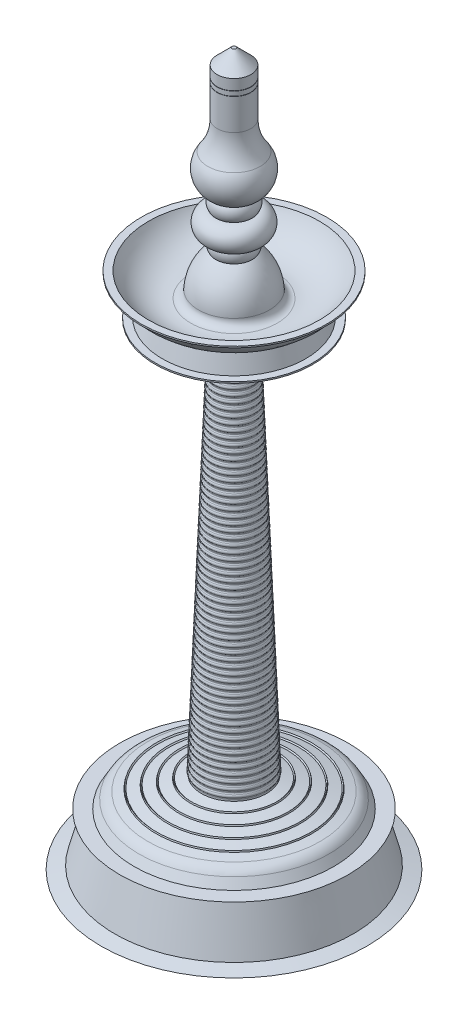
from build123d import *


with BuildPart() as part:
    # Sketch1 → Revolve1 (revolve)
    with BuildSketch(Plane.XY, mode=Mode.PRIVATE) as revolve1_sk:
        with BuildLine():
            Line((0, 0), (0, 1500))
            Line((0, 1500), (4.146366125, 1500))
            Line((4.146366125, 1500), (35.55917972, 1468.587186405))
            Line((35.55917972, 1468.587186405), (35.55917972, 1446.385384253))
            Line((35.55917972, 1446.385384253), (34.598258429, 1446.108562516))
            Line((34.598258429, 1446.108562516), (35.55917972, 1445.831740779))
            Line((35.55917972, 1445.831740779), (35.55917972, 1436.385384253))
            Line((35.55917972, 1436.385384253), (34.598258429, 1436.108562516))
            Line((34.598258429, 1436.108562516), (35.55917972, 1435.831740779))
            Line((35.55917972, 1435.831740779), (35.55917972, 1369.908923142))
            ThreePointArc((35.55917972, 1369.908923142), (40.564503358, 1338.667740979), (55.079408979, 1310.554003367))
            ThreePointArc((55.079408979, 1310.554003367), (63.664014173, 1268.692665537), (37.325157619, 1235.042529033))
            ThreePointArc((37.325157619, 1235.042529033), (42.03903574, 1221.441743023), (38.054859782, 1207.60959319))
            ThreePointArc((38.054859782, 1207.60959319), (64.086349391, 1181.890338054), (38.367094255, 1155.858848446))
            ThreePointArc((38.367094255, 1155.858848446), (41.441653525, 1144.021783008), (38.367094255, 1132.184717571))
            ThreePointArc((38.367094255, 1132.184717571), (64.372038769, 1099.328636815), (75, 1058.796851486))
            ThreePointArc((75, 1058.796851486), (79.533896643, 1047.290152225), (90.876310781, 1042.359636209))
            ThreePointArc((90.876310781, 1042.359636209), (143.636128622, 1053.500194268), (180.337905252, 1093.005763555))
            Line((180.337905252, 1093.005763555), (195.337905252, 1093.005763555))
            Line((195.337905252, 1093.005763555), (195.337905252, 1090.005763555))
            Line((195.337905252, 1090.005763555), (187.60713633, 1090.005763555))
            ThreePointArc((187.60713633, 1090.005763555), (169.093237087, 1063.190582401), (140.445446097, 1047.662463489))
            Line((140.445446097, 1047.662463489), (151.163413794, 1007.662463489))
            Line((151.163413794, 1007.662463489), (166.163413794, 1007.662463489))
            Line((166.163413794, 1007.662463489), (166.163413794, 1004.662463489))
            Line((166.163413794, 1004.662463489), (37.325157619, 1004.662463489))
            Line((37.325157619, 1004.662463489), (37.367372239, 1003.53674031))
            ThreePointArc((37.367372239, 1003.53674031), (37.683576238, 1001.96486419), (38.481059373, 1000.57389325))
            ThreePointArc((38.481059373, 1000.57389325), (39.594746508, 997.61104619), (38.7060887, 994.573111195))
            ThreePointArc((38.7060887, 994.573111195), (38.015021659, 993.126319624), (37.817430893, 991.5351762))
            Line((37.817430893, 991.5351762), (37.845161411, 990.79569571))
            ThreePointArc((37.845161411, 990.79569571), (38.161365411, 989.22381959), (38.958848546, 987.83284865))
            ThreePointArc((38.958848546, 987.83284865), (40.072535681, 984.87000159), (39.183877873, 981.832066595))
            ThreePointArc((39.183877873, 981.832066595), (38.492810832, 980.385275024), (38.295220065, 978.7941316))
            Line((38.295220065, 978.7941316), (38.322950584, 978.054651109))
            ThreePointArc((38.322950584, 978.054651109), (38.639154583, 976.482774989), (39.436637718, 975.09180405))
            ThreePointArc((39.436637718, 975.09180405), (40.550324853, 972.12895699), (39.661667045, 969.091021995))
            ThreePointArc((39.661667045, 969.091021995), (38.970600004, 967.644230424), (38.773009238, 966.053087))
            Line((38.773009238, 966.053087), (38.800739756, 965.313606509))
            ThreePointArc((38.800739756, 965.313606509), (39.116943756, 963.741730389), (39.914426891, 962.350759449))
            ThreePointArc((39.914426891, 962.350759449), (41.028114026, 959.38791239), (40.139456218, 956.349977395))
            ThreePointArc((40.139456218, 956.349977395), (39.448389177, 954.903185823), (39.25079841, 953.312042399))
            Line((39.25079841, 953.312042399), (39.278528929, 952.572561909))
            ThreePointArc((39.278528929, 952.572561909), (39.594732928, 951.000685789), (40.392216063, 949.609714849))
            ThreePointArc((40.392216063, 949.609714849), (41.505903198, 946.646867789), (40.61724539, 943.608932794))
            ThreePointArc((40.61724539, 943.608932794), (39.926178349, 942.162141223), (39.728587583, 940.570997799))
            Line((39.728587583, 940.570997799), (39.756318101, 939.831517308))
            ThreePointArc((39.756318101, 939.831517308), (40.072522101, 938.259641188), (40.870005236, 936.868670249))
            ThreePointArc((40.870005236, 936.868670249), (41.983692371, 933.905823189), (41.095034563, 930.867888194))
            ThreePointArc((41.095034563, 930.867888194), (40.403967522, 929.421096623), (40.206376755, 927.829953199))
            Line((40.206376755, 927.829953199), (40.234107274, 927.090472708))
            ThreePointArc((40.234107274, 927.090472708), (40.550311273, 925.518596588), (41.347794408, 924.127625648))
            ThreePointArc((41.347794408, 924.127625648), (42.461481543, 921.164778589), (41.572823735, 918.126843594))
            ThreePointArc((41.572823735, 918.126843594), (40.881756694, 916.680052022), (40.684165928, 915.088908599))
            Line((40.684165928, 915.088908599), (40.711896446, 914.349428108))
            ThreePointArc((40.711896446, 914.349428108), (41.028100446, 912.777551988), (41.825583581, 911.386581048))
            ThreePointArc((41.825583581, 911.386581048), (42.939270716, 908.423733988), (42.050612908, 905.385798993))
            ThreePointArc((42.050612908, 905.385798993), (41.359545867, 903.939007422), (41.1619551, 902.347863998))
            Line((41.1619551, 902.347863998), (41.189685619, 901.608383508))
            ThreePointArc((41.189685619, 901.608383508), (41.505889618, 900.036507388), (42.303372753, 898.645536448))
            ThreePointArc((42.303372753, 898.645536448), (43.417059888, 895.682689388), (42.52840208, 892.644754393))
            ThreePointArc((42.52840208, 892.644754393), (41.837335039, 891.197962822), (41.639744273, 889.606819398))
            Line((41.639744273, 889.606819398), (41.667474791, 888.867338907))
            ThreePointArc((41.667474791, 888.867338907), (41.983678791, 887.295462787), (42.781161926, 885.904491848))
            ThreePointArc((42.781161926, 885.904491848), (43.894849061, 882.941644788), (43.006191253, 879.903709793))
            ThreePointArc((43.006191253, 879.903709793), (42.315124212, 878.456918222), (42.117533445, 876.865774798))
            Line((42.117533445, 876.865774798), (42.145263964, 876.126294307))
            ThreePointArc((42.145263964, 876.126294307), (42.461467963, 874.554418187), (43.258951098, 873.163447247))
            ThreePointArc((43.258951098, 873.163447247), (44.372638233, 870.200600188), (43.483980426, 867.162665193))
            ThreePointArc((43.483980426, 867.162665193), (42.792913384, 865.715873621), (42.595322618, 864.124730197))
            Line((42.595322618, 864.124730197), (42.623053136, 863.385249707))
            ThreePointArc((42.623053136, 863.385249707), (42.939257136, 861.813373587), (43.736740271, 860.422402647))
            ThreePointArc((43.736740271, 860.422402647), (44.850427406, 857.459555587), (43.961769598, 854.421620592))
            ThreePointArc((43.961769598, 854.421620592), (43.270702557, 852.974829021), (43.07311179, 851.383685597))
            Line((43.07311179, 851.383685597), (43.100842309, 850.644205106))
            ThreePointArc((43.100842309, 850.644205106), (43.417046308, 849.072328986), (44.214529443, 847.681358047))
            ThreePointArc((44.214529443, 847.681358047), (45.328216578, 844.718510987), (44.439558771, 841.680575992))
            ThreePointArc((44.439558771, 841.680575992), (43.748491729, 840.233784421), (43.550900963, 838.642640997))
            Line((43.550900963, 838.642640997), (43.578631481, 837.903160506))
            ThreePointArc((43.578631481, 837.903160506), (43.894835481, 836.331284386), (44.692318616, 834.940313446))
            ThreePointArc((44.692318616, 834.940313446), (45.806005751, 831.977466387), (44.917347943, 828.939531392))
            ThreePointArc((44.917347943, 828.939531392), (44.226280902, 827.49273982), (44.028690135, 825.901596397))
            Line((44.028690135, 825.901596397), (44.056420654, 825.162115906))
            ThreePointArc((44.056420654, 825.162115906), (44.372624653, 823.590239786), (45.170107789, 822.199268846))
            ThreePointArc((45.170107789, 822.199268846), (46.283794923, 819.236421786), (45.395137116, 816.198486791))
            ThreePointArc((45.395137116, 816.198486791), (44.704070074, 814.75169522), (44.506479308, 813.160551796))
            Line((44.506479308, 813.160551796), (44.534209826, 812.421071306))
            ThreePointArc((44.534209826, 812.421071306), (44.850413826, 810.849195185), (45.647896961, 809.458224246))
            ThreePointArc((45.647896961, 809.458224246), (46.761584096, 806.495377186), (45.872926288, 803.457442191))
            ThreePointArc((45.872926288, 803.457442191), (45.181859247, 802.01065062), (44.98426848, 800.419507196))
            Line((44.98426848, 800.419507196), (45.011998999, 799.680026705))
            ThreePointArc((45.011998999, 799.680026705), (45.328202998, 798.108150585), (46.125686134, 796.717179646))
            ThreePointArc((46.125686134, 796.717179646), (47.239373268, 793.754332586), (46.350715461, 790.716397591))
            ThreePointArc((46.350715461, 790.716397591), (45.65964842, 789.269606019), (45.462057653, 787.678462596))
            Line((45.462057653, 787.678462596), (45.489788171, 786.938982105))
            ThreePointArc((45.489788171, 786.938982105), (45.805992171, 785.367105985), (46.603475306, 783.976135045))
            ThreePointArc((46.603475306, 783.976135045), (47.717162441, 781.013287986), (46.828504633, 777.97535299))
            ThreePointArc((46.828504633, 777.97535299), (46.137437592, 776.528561419), (45.939846825, 774.937417995))
            Line((45.939846825, 774.937417995), (45.967577344, 774.197937505))
            ThreePointArc((45.967577344, 774.197937505), (46.283781343, 772.626061385), (47.081264479, 771.235090445))
            ThreePointArc((47.081264479, 771.235090445), (48.194951613, 768.272243385), (47.306293806, 765.23430839))
            ThreePointArc((47.306293806, 765.23430839), (46.615226765, 763.787516819), (46.417635998, 762.196373395))
            Line((46.417635998, 762.196373395), (46.445366516, 761.456892904))
            ThreePointArc((46.445366516, 761.456892904), (46.761570516, 759.885016784), (47.559053651, 758.494045845))
            ThreePointArc((47.559053651, 758.494045845), (48.672740786, 755.531198785), (47.784082978, 752.49326379))
            ThreePointArc((47.784082978, 752.49326379), (47.093015937, 751.046472219), (46.89542517, 749.455328795))
            Line((46.89542517, 749.455328795), (46.923155689, 748.715848304))
            ThreePointArc((46.923155689, 748.715848304), (47.239359688, 747.143972184), (48.036842824, 745.753001244))
            ThreePointArc((48.036842824, 745.753001244), (49.150529958, 742.790154185), (48.261872151, 739.75221919))
            ThreePointArc((48.261872151, 739.75221919), (47.57080511, 738.305427618), (47.373214343, 736.714284195))
            Line((47.373214343, 736.714284195), (47.400944861, 735.974803704))
            ThreePointArc((47.400944861, 735.974803704), (47.717148861, 734.402927584), (48.514631996, 733.011956644))
            ThreePointArc((48.514631996, 733.011956644), (49.628319131, 730.049109584), (48.739661323, 727.011174589))
            ThreePointArc((48.739661323, 727.011174589), (48.048594282, 725.564383018), (47.851003515, 723.973239594))
            Line((47.851003515, 723.973239594), (47.878734034, 723.233759103))
            ThreePointArc((47.878734034, 723.233759103), (48.194938033, 721.661882983), (48.992421169, 720.270912044))
            ThreePointArc((48.992421169, 720.270912044), (50.106108303, 717.308064984), (49.217450496, 714.270129989))
            ThreePointArc((49.217450496, 714.270129989), (48.526383455, 712.823338418), (48.328792688, 711.232194994))
            Line((48.328792688, 711.232194994), (48.356523206, 710.492714503))
            ThreePointArc((48.356523206, 710.492714503), (48.672727206, 708.920838383), (49.470210341, 707.529867443))
            ThreePointArc((49.470210341, 707.529867443), (50.583897476, 704.567020384), (49.695239668, 701.529085389))
            ThreePointArc((49.695239668, 701.529085389), (49.004172627, 700.082293817), (48.80658186, 698.491150394))
            Line((48.80658186, 698.491150394), (48.834312379, 697.751669903))
            ThreePointArc((48.834312379, 697.751669903), (49.150516378, 696.179793783), (49.947999514, 694.788822843))
            ThreePointArc((49.947999514, 694.788822843), (51.061686648, 691.825975783), (50.173028841, 688.788040788))
            ThreePointArc((50.173028841, 688.788040788), (49.4819618, 687.341249217), (49.284371033, 685.750105793))
            Line((49.284371033, 685.750105793), (49.312101551, 685.010625303))
            ThreePointArc((49.312101551, 685.010625303), (49.628305551, 683.438749183), (50.425788686, 682.047778243))
            ThreePointArc((50.425788686, 682.047778243), (51.539475821, 679.084931183), (50.650818013, 676.046996188))
            ThreePointArc((50.650818013, 676.046996188), (49.959750972, 674.600204617), (49.762160205, 673.009061193))
            Line((49.762160205, 673.009061193), (49.789890724, 672.269580702))
            ThreePointArc((49.789890724, 672.269580702), (50.106094723, 670.697704582), (50.903577859, 669.306733643))
            ThreePointArc((50.903577859, 669.306733643), (52.017264993, 666.343886583), (51.128607186, 663.305951588))
            ThreePointArc((51.128607186, 663.305951588), (50.437540145, 661.859160017), (50.239949378, 660.268016593))
            Line((50.239949378, 660.268016593), (50.267679896, 659.528536102))
            ThreePointArc((50.267679896, 659.528536102), (50.583883896, 657.956659982), (51.381367031, 656.565689042))
            ThreePointArc((51.381367031, 656.565689042), (52.495054166, 653.602841983), (51.606396358, 650.564906988))
            ThreePointArc((51.606396358, 650.564906988), (50.915329317, 649.118115416), (50.717738551, 647.526971992))
            Line((50.717738551, 647.526971992), (50.745469069, 646.787491502))
            ThreePointArc((50.745469069, 646.787491502), (51.061673068, 645.215615382), (51.859156204, 643.824644442))
            ThreePointArc((51.859156204, 643.824644442), (52.972843338, 640.861797382), (52.084185531, 637.823862387))
            ThreePointArc((52.084185531, 637.823862387), (51.39311849, 636.377070816), (51.195527723, 634.785927392))
            Line((51.195527723, 634.785927392), (51.223258241, 634.046446901))
            ThreePointArc((51.223258241, 634.046446901), (51.539462241, 632.474570781), (52.336945376, 631.083599842))
            ThreePointArc((52.336945376, 631.083599842), (53.450632511, 628.120752782), (52.561974703, 625.082817787))
            ThreePointArc((52.561974703, 625.082817787), (51.870907662, 623.636026216), (51.673316896, 622.044882792))
            Line((51.673316896, 622.044882792), (51.701047414, 621.305402301))
            ThreePointArc((51.701047414, 621.305402301), (52.017251413, 619.733526181), (52.814734549, 618.342555241))
            ThreePointArc((52.814734549, 618.342555241), (53.928421684, 615.379708182), (53.039763876, 612.341773187))
            ThreePointArc((53.039763876, 612.341773187), (52.348696835, 610.894981615), (52.151106068, 609.303838192))
            Line((52.151106068, 609.303838192), (52.178836586, 608.564357701))
            ThreePointArc((52.178836586, 608.564357701), (52.495040586, 606.992481581), (53.292523721, 605.601510641))
            ThreePointArc((53.292523721, 605.601510641), (54.406210856, 602.638663581), (53.517553048, 599.600728586))
            ThreePointArc((53.517553048, 599.600728586), (52.826486007, 598.153937015), (52.628895241, 596.562793591))
            Line((52.628895241, 596.562793591), (52.656625759, 595.823313101))
            ThreePointArc((52.656625759, 595.823313101), (52.972829759, 594.251436981), (53.770312894, 592.860466041))
            ThreePointArc((53.770312894, 592.860466041), (54.884000029, 589.897618981), (53.995342221, 586.859683986))
            ThreePointArc((53.995342221, 586.859683986), (53.30427518, 585.412892415), (53.106684413, 583.821748991))
            Line((53.106684413, 583.821748991), (53.134414931, 583.0822685))
            ThreePointArc((53.134414931, 583.0822685), (53.450618931, 581.51039238), (54.248102066, 580.119421441))
            ThreePointArc((54.248102066, 580.119421441), (55.361789201, 577.156574381), (54.473131393, 574.118639386))
            ThreePointArc((54.473131393, 574.118639386), (53.782064352, 572.671847815), (53.584473586, 571.080704391))
            Line((53.584473586, 571.080704391), (53.612204104, 570.3412239))
            ThreePointArc((53.612204104, 570.3412239), (53.928408104, 568.76934778), (54.725891239, 567.37837684))
            ThreePointArc((54.725891239, 567.37837684), (55.839578374, 564.415529781), (54.950920566, 561.377594786))
            ThreePointArc((54.950920566, 561.377594786), (54.259853525, 559.930803214), (54.062262758, 558.33965979))
            Line((54.062262758, 558.33965979), (54.089993277, 557.6001793))
            ThreePointArc((54.089993277, 557.6001793), (54.406197276, 556.02830318), (55.203680411, 554.63733224))
            ThreePointArc((55.203680411, 554.63733224), (56.317367546, 551.67448518), (55.428709738, 548.636550185))
            ThreePointArc((55.428709738, 548.636550185), (54.737642697, 547.189758614), (54.540051931, 545.59861519))
            Line((54.540051931, 545.59861519), (54.567782449, 544.859134699))
            ThreePointArc((54.567782449, 544.859134699), (54.883986449, 543.287258579), (55.681469584, 541.89628764))
            ThreePointArc((55.681469584, 541.89628764), (56.795156719, 538.93344058), (55.906498911, 535.895505585))
            ThreePointArc((55.906498911, 535.895505585), (55.21543187, 534.448714014), (55.017841103, 532.85757059))
            Line((55.017841103, 532.85757059), (55.045571622, 532.118090099))
            ThreePointArc((55.045571622, 532.118090099), (55.361775621, 530.546213979), (56.159258756, 529.155243039))
            ThreePointArc((56.159258756, 529.155243039), (57.272945891, 526.19239598), (56.384288083, 523.154460985))
            ThreePointArc((56.384288083, 523.154460985), (55.693221042, 521.707669413), (55.495630276, 520.11652599))
            Line((55.495630276, 520.11652599), (55.523360794, 519.377045499))
            ThreePointArc((55.523360794, 519.377045499), (55.839564794, 517.805169379), (56.637047929, 516.414198439))
            ThreePointArc((56.637047929, 516.414198439), (57.750735064, 513.451351379), (56.862077256, 510.413416384))
            ThreePointArc((56.862077256, 510.413416384), (56.171010215, 508.966624813), (55.973419448, 507.375481389))
            Line((55.973419448, 507.375481389), (56.001149967, 506.636000899))
            ThreePointArc((56.001149967, 506.636000899), (56.317353966, 505.064124778), (57.114837101, 503.673153839))
            ThreePointArc((57.114837101, 503.673153839), (58.228524236, 500.710306779), (57.339866428, 497.672371784))
            ThreePointArc((57.339866428, 497.672371784), (56.648799387, 496.225580213), (56.451208621, 494.634436789))
            Line((56.451208621, 494.634436789), (56.478939139, 493.894956298))
            ThreePointArc((56.478939139, 493.894956298), (56.795143139, 492.323080178), (57.592626274, 490.932109239))
            ThreePointArc((57.592626274, 490.932109239), (58.706313409, 487.969262179), (57.817655601, 484.931327184))
            ThreePointArc((57.817655601, 484.931327184), (57.12658856, 483.484535612), (56.928997793, 481.893392189))
            Line((56.928997793, 481.893392189), (56.956728312, 481.153911698))
            ThreePointArc((56.956728312, 481.153911698), (57.272932311, 479.582035578), (58.070415446, 478.191064638))
            ThreePointArc((58.070415446, 478.191064638), (59.184102581, 475.228217579), (58.295444773, 472.190282583))
            ThreePointArc((58.295444773, 472.190282583), (57.604377732, 470.743491012), (57.406786966, 469.152347588))
            Line((57.406786966, 469.152347588), (57.434517484, 468.412867098))
            ThreePointArc((57.434517484, 468.412867098), (57.750721484, 466.840990978), (58.548204619, 465.450020038))
            ThreePointArc((58.548204619, 465.450020038), (59.661891754, 462.487172978), (58.773233946, 459.449237983))
            ThreePointArc((58.773233946, 459.449237983), (58.082166905, 458.002446412), (57.884576138, 456.411302988))
            Line((57.884576138, 456.411302988), (57.912306657, 455.671822497))
            ThreePointArc((57.912306657, 455.671822497), (58.228510656, 454.099946377), (59.025993791, 452.708975438))
            ThreePointArc((59.025993791, 452.708975438), (60.139680926, 449.746128378), (59.251023118, 446.708193383))
            ThreePointArc((59.251023118, 446.708193383), (58.559956077, 445.261401812), (58.362365311, 443.670258388))
            Line((58.362365311, 443.670258388), (58.390095829, 442.930777897))
            ThreePointArc((58.390095829, 442.930777897), (58.706299829, 441.358901777), (59.503782964, 439.967930837))
            ThreePointArc((59.503782964, 439.967930837), (60.617470099, 437.005083778), (59.728812291, 433.967148783))
            ThreePointArc((59.728812291, 433.967148783), (59.03774525, 432.520357211), (58.840154483, 430.929213788))
            Line((58.840154483, 430.929213788), (58.867885002, 430.189733297))
            ThreePointArc((58.867885002, 430.189733297), (59.184089001, 428.617857177), (59.981572136, 427.226886237))
            ThreePointArc((59.981572136, 427.226886237), (61.095259271, 424.264039177), (60.206601463, 421.226104182))
            ThreePointArc((60.206601463, 421.226104182), (59.515534422, 419.779312611), (59.317943656, 418.188169187))
            Line((59.317943656, 418.188169187), (59.345674174, 417.448688696))
            ThreePointArc((59.345674174, 417.448688696), (59.661878174, 415.876812576), (60.459361309, 414.485841637))
            ThreePointArc((60.459361309, 414.485841637), (61.573048444, 411.522994577), (60.684390636, 408.485059582))
            ThreePointArc((60.684390636, 408.485059582), (59.993323595, 407.038268011), (59.795732828, 405.447124587))
            Line((59.795732828, 405.447124587), (59.823463347, 404.707644096))
            ThreePointArc((59.823463347, 404.707644096), (60.139667346, 403.135767976), (60.937150481, 401.744797036))
            ThreePointArc((60.937150481, 401.744797036), (62.050837616, 398.781949977), (61.162179809, 395.744014982))
            ThreePointArc((61.162179809, 395.744014982), (60.471112767, 394.29722341), (60.273522001, 392.706079987))
            Line((60.273522001, 392.706079987), (60.301252519, 391.966599496))
            ThreePointArc((60.301252519, 391.966599496), (60.617456519, 390.394723376), (61.414939654, 389.003752436))
            ThreePointArc((61.414939654, 389.003752436), (62.528626789, 386.040905376), (61.639968981, 383.002970381))
            ThreePointArc((61.639968981, 383.002970381), (60.94890194, 381.55617881), (60.751311173, 379.965035386))
            Line((60.751311173, 379.965035386), (60.779041692, 379.225554896))
            ThreePointArc((60.779041692, 379.225554896), (61.095245691, 377.653678776), (61.892728826, 376.262707836))
            ThreePointArc((61.892728826, 376.262707836), (63.006415961, 373.299860776), (62.117758154, 370.261925781))
            ThreePointArc((62.117758154, 370.261925781), (61.426691112, 368.81513421), (61.229100346, 367.223990786))
            Line((61.229100346, 367.223990786), (61.256830864, 366.484510295))
            ThreePointArc((61.256830864, 366.484510295), (61.573034864, 364.912634175), (62.370517999, 363.521663236))
            ThreePointArc((62.370517999, 363.521663236), (63.484205134, 360.558816176), (62.595547326, 357.520881181))
            ThreePointArc((62.595547326, 357.520881181), (61.904480285, 356.07408961), (61.706889518, 354.482946186))
            Line((61.706889518, 354.482946186), (61.734620037, 353.743465695))
            ThreePointArc((61.734620037, 353.743465695), (62.050824036, 352.171589575), (62.848307172, 350.780618635))
            ThreePointArc((62.848307172, 350.780618635), (63.961994306, 347.817771576), (63.073336499, 344.779836581))
            ThreePointArc((63.073336499, 344.779836581), (62.382269457, 343.333045009), (62.184678691, 341.741901585))
            Line((62.184678691, 341.741901585), (62.212409209, 341.002421095))
            ThreePointArc((62.212409209, 341.002421095), (62.528613209, 339.430544975), (63.326096344, 338.039574035))
            ThreePointArc((63.326096344, 338.039574035), (64.439783479, 335.076726975), (63.551125671, 332.03879198))
            ThreePointArc((63.551125671, 332.03879198), (62.86005863, 330.592000409), (62.662467863, 329.000856985))
            Line((62.662467863, 329.000856985), (62.690198382, 328.261376494))
            ThreePointArc((62.690198382, 328.261376494), (63.006402381, 326.689500374), (63.803885517, 325.298529435))
            ThreePointArc((63.803885517, 325.298529435), (64.917572651, 322.335682375), (64.028914844, 319.29774738))
            ThreePointArc((64.028914844, 319.29774738), (63.337847803, 317.850955809), (63.140257036, 316.259812385))
            Line((63.140257036, 316.259812385), (63.167987554, 315.520331894))
            ThreePointArc((63.167987554, 315.520331894), (63.484191554, 313.948455774), (64.281674689, 312.557484834))
            ThreePointArc((64.281674689, 312.557484834), (65.395361824, 309.594637775), (64.506704016, 306.55670278))
            ThreePointArc((64.506704016, 306.55670278), (63.815636975, 305.109911208), (63.618046208, 303.518767785))
            Line((63.618046208, 303.518767785), (63.645776727, 302.779287294))
            ThreePointArc((63.645776727, 302.779287294), (63.961980726, 301.207411174), (64.759463862, 299.816440234))
            ThreePointArc((64.759463862, 299.816440234), (65.873150996, 296.853593174), (64.984493189, 293.815658179))
            ThreePointArc((64.984493189, 293.815658179), (64.293426148, 292.368866608), (64.095835381, 290.777723184))
            Line((64.095835381, 290.777723184), (64.123565899, 290.038242694))
            ThreePointArc((64.123565899, 290.038242694), (64.439769899, 288.466366574), (65.237253034, 287.075395634))
            ThreePointArc((65.237253034, 287.075395634), (66.350940169, 284.112548574), (65.462282361, 281.074613579))
            ThreePointArc((65.462282361, 281.074613579), (64.77121532, 279.627822008), (64.573624553, 278.036678584))
            Line((64.573624553, 278.036678584), (64.601355072, 277.297198093))
            ThreePointArc((64.601355072, 277.297198093), (64.917559071, 275.725321973), (65.715042207, 274.334351034))
            ThreePointArc((65.715042207, 274.334351034), (66.828729341, 271.371503974), (65.940071534, 268.333568979))
            ThreePointArc((65.940071534, 268.333568979), (65.249004493, 266.886777407), (65.051413726, 265.295633984))
            Line((65.051413726, 265.295633984), (65.079144244, 264.556153493))
            ThreePointArc((65.079144244, 264.556153493), (65.395348244, 262.984277373), (66.192831379, 261.593306433))
            ThreePointArc((66.192831379, 261.593306433), (67.306518514, 258.630459374), (66.417860706, 255.592524378))
            ThreePointArc((66.417860706, 255.592524378), (65.726793665, 254.145732807), (65.529202898, 252.554589383))
            Line((65.529202898, 252.554589383), (65.556933417, 251.815108893))
            ThreePointArc((65.556933417, 251.815108893), (65.873137416, 250.243232773), (66.670620552, 248.852261833))
            ThreePointArc((66.670620552, 248.852261833), (67.784307686, 245.889414773), (66.895649879, 242.851479778))
            ThreePointArc((66.895649879, 242.851479778), (66.204582838, 241.404688207), (66.006992071, 239.813544783))
            Line((66.006992071, 239.813544783), (66.034722589, 239.074064292))
            ThreePointArc((66.034722589, 239.074064292), (66.350926589, 237.502188172), (67.148409724, 236.111217233))
            ThreePointArc((67.148409724, 236.111217233), (68.262096859, 233.148370173), (67.373439051, 230.110435178))
            ThreePointArc((67.373439051, 230.110435178), (66.68237201, 228.663643607), (66.484781243, 227.072500183))
            Line((66.484781243, 227.072500183), (66.512511762, 226.333019692))
            ThreePointArc((66.512511762, 226.333019692), (66.828715761, 224.761143572), (67.626198897, 223.370172632))
            ThreePointArc((67.626198897, 223.370172632), (68.739886031, 220.407325573), (67.851228224, 217.369390578))
            ThreePointArc((67.851228224, 217.369390578), (67.160161183, 215.922599006), (66.962570416, 214.331455583))
            Line((66.962570416, 214.331455583), (66.990300934, 213.591975092))
            ThreePointArc((66.990300934, 213.591975092), (67.306504934, 212.020098972), (68.103988069, 210.629128032))
            ThreePointArc((68.103988069, 210.629128032), (69.217675204, 207.666280972), (68.329017396, 204.628345977))
            ThreePointArc((68.329017396, 204.628345977), (67.637950355, 203.181554406), (67.440359588, 201.590410982))
            Line((67.440359588, 201.590410982), (67.468090107, 200.850930492))
            ThreePointArc((67.468090107, 200.850930492), (67.784294106, 199.279054371), (68.581777242, 197.888083432))
            ThreePointArc((68.581777242, 197.888083432), (69.695464376, 194.925236372), (68.806806569, 191.887301377))
            ThreePointArc((68.806806569, 191.887301377), (68.115739528, 190.440509806), (67.918148761, 188.849366382))
            Line((67.918148761, 188.849366382), (67.945879279, 188.109885891))
            ThreePointArc((67.945879279, 188.109885891), (68.262083279, 186.538009771), (69.059566414, 185.147038832))
            ThreePointArc((69.059566414, 185.147038832), (70.173253549, 182.184191772), (69.284595741, 179.146256777))
            ThreePointArc((69.284595741, 179.146256777), (68.5935287, 177.699465205), (68.395937934, 176.108321782))
            Line((68.395937934, 176.108321782), (68.519286559, 172.819025101))
            Line((68.519286559, 172.819025101), (88.754990438, 167.396884588))
            Line((88.754990438, 167.396884588), (90.876310781, 169.518204932))
            Line((90.876310781, 169.518204932), (91.652767917, 166.620427453))
            Line((91.652767917, 166.620427453), (112.903136095, 160.926408461))
            Line((112.903136095, 160.926408461), (115.024456438, 163.047728804))
            Line((115.024456438, 163.047728804), (115.800913574, 160.149951325))
            Line((115.800913574, 160.149951325), (137.051281752, 154.455932333))
            Line((137.051281752, 154.455932333), (139.172602096, 156.577252677))
            Line((139.172602096, 156.577252677), (139.949059231, 153.679475198))
            Line((139.949059231, 153.679475198), (161.199427409, 147.985456206))
            Line((161.199427409, 147.985456206), (163.320747753, 150.106776549))
            Line((163.320747753, 150.106776549), (164.097204888, 147.20899907))
            Line((164.097204888, 147.20899907), (182.086656651, 142.388739998))
            ThreePointArc((182.086656651, 142.388739998), (192.584928169, 137.211565418), (200.302847412, 128.410965209))
            Line((200.302847412, 128.410965209), (210.560309062, 110.644520475))
            Line((210.560309062, 110.644520475), (240.560309062, 110.644520475))
            Line((240.560309062, 110.644520475), (224.227305968, 107.764571353))
            Line((224.227305968, 107.764571353), (251.022225211, 7.764571353))
            Line((251.022225211, 7.764571353), (280, 0))
            Line((280, 0), (0, 0))
        make_face()
    revolve(revolve1_sk.sketch.rotate(Axis((0, 0, 0), (0, 1, 0)), 90), axis=Axis((0, 0, 0), (0, 1, 0)))


solid = part.part
